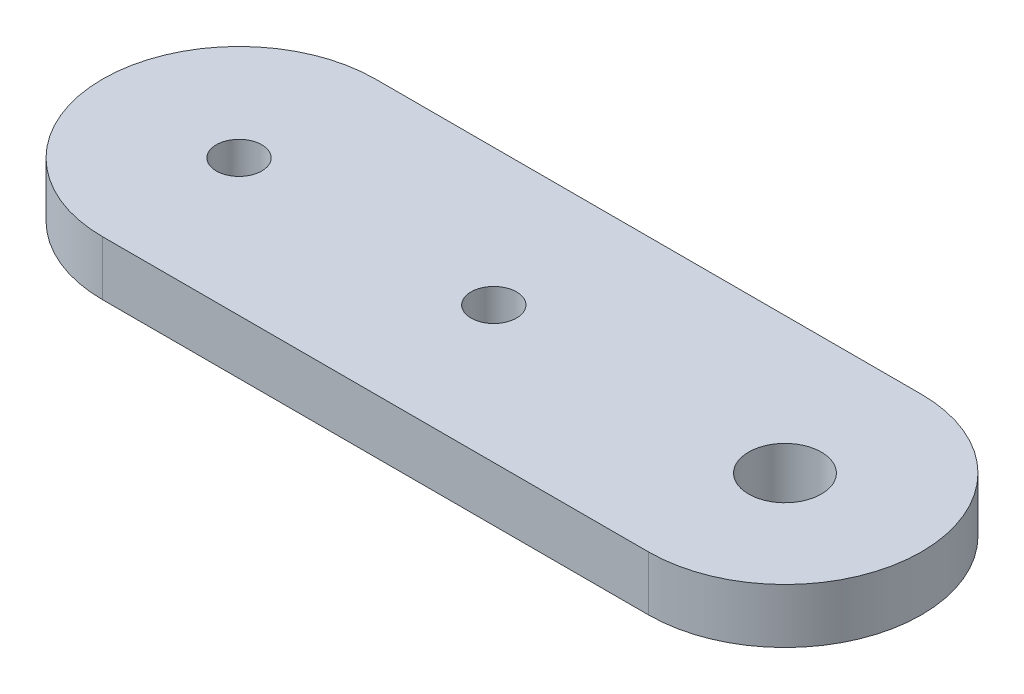
from build123d import *

# Parameters (mm, degrees)
SKETCH1_R           = 2
SKETCH1_R_2         = 1.25
BOSS_EXTRUDE1_DEPTH = 3


with BuildPart() as part:
    # Sketch1 → Boss-Extrude1 (new body)
    with BuildSketch(Plane(origin=(0, 0, 0), x_dir=(1, 0, 0), z_dir=(0, 1, 0))):
        with BuildLine():
            Line((0, 7.5), (30, 7.5))
            ThreePointArc((30, 7.5), (37.5, 0), (30, -7.5))
            Line((30, -7.5), (0, -7.5))
            ThreePointArc((0, -7.5), (-7.5, 0), (0, 7.5))
        make_face()
        with Locations(Location((30, 0, 0), (0, 0, 270))):
            Circle(SKETCH1_R, mode=Mode.SUBTRACT)
        with Locations(Location((0, 0, 0), (0, 0, 270))):
            Circle(SKETCH1_R_2, mode=Mode.SUBTRACT)
        with Locations(Location((14, 0, 0), (0, 0, 270))):
            Circle(SKETCH1_R_2, mode=Mode.SUBTRACT)
    extrude(amount=BOSS_EXTRUDE1_DEPTH)


solid = part.part
